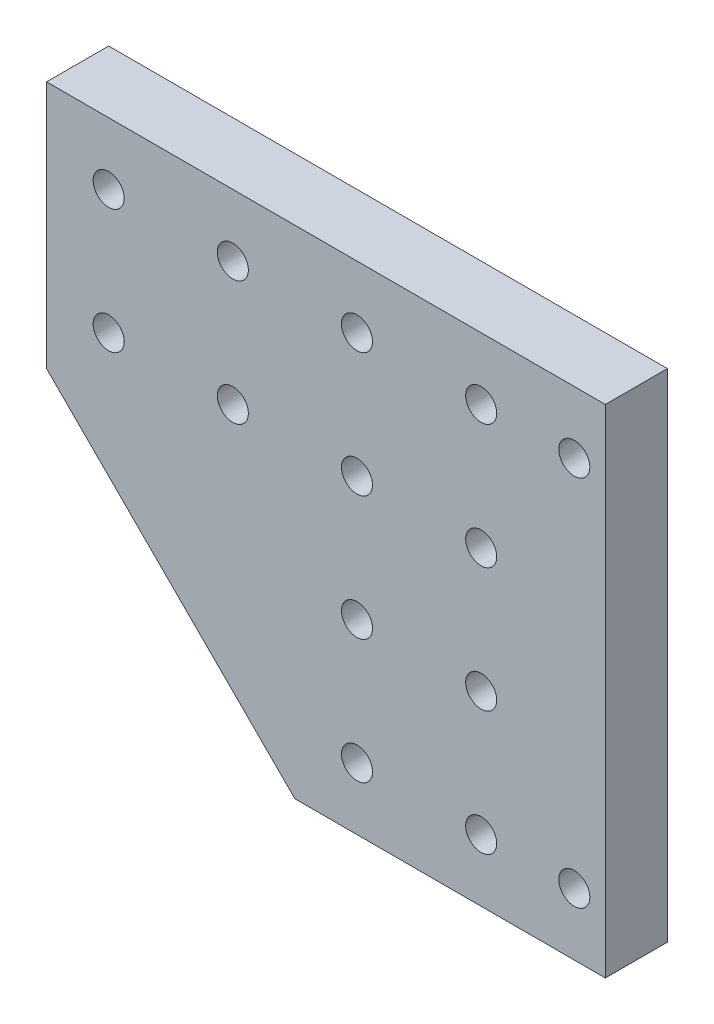
from build123d import *

# Parameters (mm, degrees)
BOSS_EXTRUDE1_DEPTH = 10
CUT_EXTRUDE1_REACH  = 96.868
SKETCH2_R           = 2.5


with BuildPart() as part:
    # Sketch1 → Boss-Extrude1 (new body)
    with BuildSketch(Plane.XY):
        Polygon((0, 0), (50, 0), (50, 80), (-40, 80), (-40, 40), align=None)
    extrude(amount=BOSS_EXTRUDE1_DEPTH)

    # Sketch2 → Cut-Extrude1 (cut, up to next)
    with BuildSketch(Plane.XY.offset(10), mode=Mode.PRIVATE) as cut_extrude1_sk1:
        with Locations((10, 10)):
            Circle(SKETCH2_R)
    cut_extrude1_tool1 = extrude(cut_extrude1_sk1.sketch, amount=-CUT_EXTRUDE1_REACH, mode=Mode.PRIVATE) & part.part
    # Sketch2 → Cut-Extrude1 (cut, up to next)
    with BuildSketch(Plane.XY.offset(10), mode=Mode.PRIVATE) as cut_extrude1_sk2:
        with Locations((30, 10)):
            Circle(SKETCH2_R)
    cut_extrude1_tool2 = extrude(cut_extrude1_sk2.sketch, amount=-CUT_EXTRUDE1_REACH, mode=Mode.PRIVATE) & part.part
    # Sketch2 → Cut-Extrude1 (cut, up to next)
    with BuildSketch(Plane.XY.offset(10), mode=Mode.PRIVATE) as cut_extrude1_sk3:
        with Locations((10, 30)):
            Circle(SKETCH2_R)
    cut_extrude1_tool3 = extrude(cut_extrude1_sk3.sketch, amount=-CUT_EXTRUDE1_REACH, mode=Mode.PRIVATE) & part.part
    # Sketch2 → Cut-Extrude1 (cut, up to next)
    with BuildSketch(Plane.XY.offset(10), mode=Mode.PRIVATE) as cut_extrude1_sk4:
        with Locations((30, 30)):
            Circle(SKETCH2_R)
    cut_extrude1_tool4 = extrude(cut_extrude1_sk4.sketch, amount=-CUT_EXTRUDE1_REACH, mode=Mode.PRIVATE) & part.part
    # Sketch2 → Cut-Extrude1 (cut, up to next)
    with BuildSketch(Plane.XY.offset(10), mode=Mode.PRIVATE) as cut_extrude1_sk5:
        with Locations((10, 50)):
            Circle(SKETCH2_R)
    cut_extrude1_tool5 = extrude(cut_extrude1_sk5.sketch, amount=-CUT_EXTRUDE1_REACH, mode=Mode.PRIVATE) & part.part
    # Sketch2 → Cut-Extrude1 (cut, up to next)
    with BuildSketch(Plane.XY.offset(10), mode=Mode.PRIVATE) as cut_extrude1_sk6:
        with Locations((30, 50)):
            Circle(SKETCH2_R)
    cut_extrude1_tool6 = extrude(cut_extrude1_sk6.sketch, amount=-CUT_EXTRUDE1_REACH, mode=Mode.PRIVATE) & part.part
    # Sketch2 → Cut-Extrude1 (cut, up to next)
    with BuildSketch(Plane.XY.offset(10), mode=Mode.PRIVATE) as cut_extrude1_sk7:
        with Locations((10, 70)):
            Circle(SKETCH2_R)
    cut_extrude1_tool7 = extrude(cut_extrude1_sk7.sketch, amount=-CUT_EXTRUDE1_REACH, mode=Mode.PRIVATE) & part.part
    # Sketch2 → Cut-Extrude1 (cut, up to next)
    with BuildSketch(Plane.XY.offset(10), mode=Mode.PRIVATE) as cut_extrude1_sk8:
        with Locations((30, 70)):
            Circle(SKETCH2_R)
    cut_extrude1_tool8 = extrude(cut_extrude1_sk8.sketch, amount=-CUT_EXTRUDE1_REACH, mode=Mode.PRIVATE) & part.part
    # Sketch2 → Cut-Extrude1 (cut, up to next)
    with BuildSketch(Plane.XY.offset(10), mode=Mode.PRIVATE) as cut_extrude1_sk9:
        with Locations((-30, 50)):
            Circle(SKETCH2_R)
    cut_extrude1_tool9 = extrude(cut_extrude1_sk9.sketch, amount=-CUT_EXTRUDE1_REACH, mode=Mode.PRIVATE) & part.part
    # Sketch2 → Cut-Extrude1 (cut, up to next)
    with BuildSketch(Plane.XY.offset(10), mode=Mode.PRIVATE) as cut_extrude1_sk10:
        with Locations((-10, 50)):
            Circle(SKETCH2_R)
    cut_extrude1_tool10 = extrude(cut_extrude1_sk10.sketch, amount=-CUT_EXTRUDE1_REACH, mode=Mode.PRIVATE) & part.part
    # Sketch2 → Cut-Extrude1 (cut, up to next)
    with BuildSketch(Plane.XY.offset(10), mode=Mode.PRIVATE) as cut_extrude1_sk11:
        with Locations((-30, 70)):
            Circle(SKETCH2_R)
    cut_extrude1_tool11 = extrude(cut_extrude1_sk11.sketch, amount=-CUT_EXTRUDE1_REACH, mode=Mode.PRIVATE) & part.part
    # Sketch2 → Cut-Extrude1 (cut, up to next)
    with BuildSketch(Plane.XY.offset(10), mode=Mode.PRIVATE) as cut_extrude1_sk12:
        with Locations((-10, 70)):
            Circle(SKETCH2_R)
    cut_extrude1_tool12 = extrude(cut_extrude1_sk12.sketch, amount=-CUT_EXTRUDE1_REACH, mode=Mode.PRIVATE) & part.part
    # Sketch2 → Cut-Extrude1 (cut, up to next)
    with BuildSketch(Plane.XY.offset(10), mode=Mode.PRIVATE) as cut_extrude1_sk13:
        with Locations((45, 10)):
            Circle(SKETCH2_R)
    cut_extrude1_tool13 = extrude(cut_extrude1_sk13.sketch, amount=-CUT_EXTRUDE1_REACH, mode=Mode.PRIVATE) & part.part
    # Sketch2 → Cut-Extrude1 (cut, up to next)
    with BuildSketch(Plane.XY.offset(10), mode=Mode.PRIVATE) as cut_extrude1_sk14:
        with Locations((45, 70)):
            Circle(SKETCH2_R)
    cut_extrude1_tool14 = extrude(cut_extrude1_sk14.sketch, amount=-CUT_EXTRUDE1_REACH, mode=Mode.PRIVATE) & part.part
    add(cut_extrude1_tool1.solids().sort_by_distance((10, 10, 10))[0], mode=Mode.SUBTRACT)
    add(cut_extrude1_tool2.solids().sort_by_distance((30, 10, 10))[0], mode=Mode.SUBTRACT)
    add(cut_extrude1_tool3.solids().sort_by_distance((10, 30, 10))[0], mode=Mode.SUBTRACT)
    add(cut_extrude1_tool4.solids().sort_by_distance((30, 30, 10))[0], mode=Mode.SUBTRACT)
    add(cut_extrude1_tool5.solids().sort_by_distance((10, 50, 10))[0], mode=Mode.SUBTRACT)
    add(cut_extrude1_tool6.solids().sort_by_distance((30, 50, 10))[0], mode=Mode.SUBTRACT)
    add(cut_extrude1_tool7.solids().sort_by_distance((10, 70, 10))[0], mode=Mode.SUBTRACT)
    add(cut_extrude1_tool8.solids().sort_by_distance((30, 70, 10))[0], mode=Mode.SUBTRACT)
    add(cut_extrude1_tool9.solids().sort_by_distance((-30, 50, 10))[0], mode=Mode.SUBTRACT)
    add(cut_extrude1_tool10.solids().sort_by_distance((-10, 50, 10))[0], mode=Mode.SUBTRACT)
    add(cut_extrude1_tool11.solids().sort_by_distance((-30, 70, 10))[0], mode=Mode.SUBTRACT)
    add(cut_extrude1_tool12.solids().sort_by_distance((-10, 70, 10))[0], mode=Mode.SUBTRACT)
    add(cut_extrude1_tool13.solids().sort_by_distance((45, 10, 10))[0], mode=Mode.SUBTRACT)
    add(cut_extrude1_tool14.solids().sort_by_distance((45, 70, 10))[0], mode=Mode.SUBTRACT)


solid = part.part
